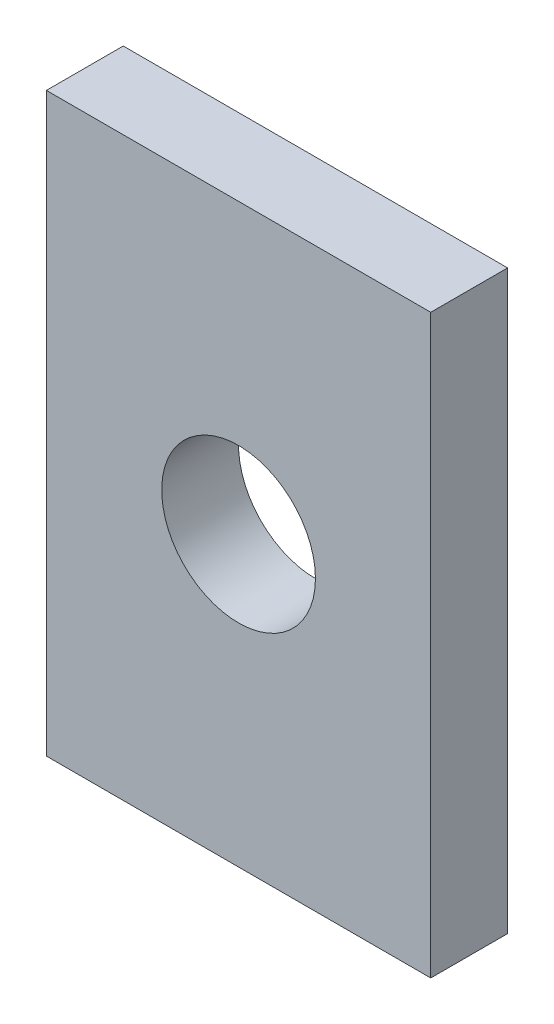
from build123d import *

# Parameters (mm, degrees)
SKETCH1_W           = 40
SKETCH1_H           = 60
SKETCH1_R           = 8
BOSS_EXTRUDE1_DEPTH = 8


with BuildPart() as part:
    # Sketch1 → Boss-Extrude1 (new body)
    with BuildSketch(Plane.XY):
        Rectangle(SKETCH1_W, SKETCH1_H)
        Circle(SKETCH1_R, mode=Mode.SUBTRACT)
    extrude(amount=BOSS_EXTRUDE1_DEPTH)


solid = part.part
